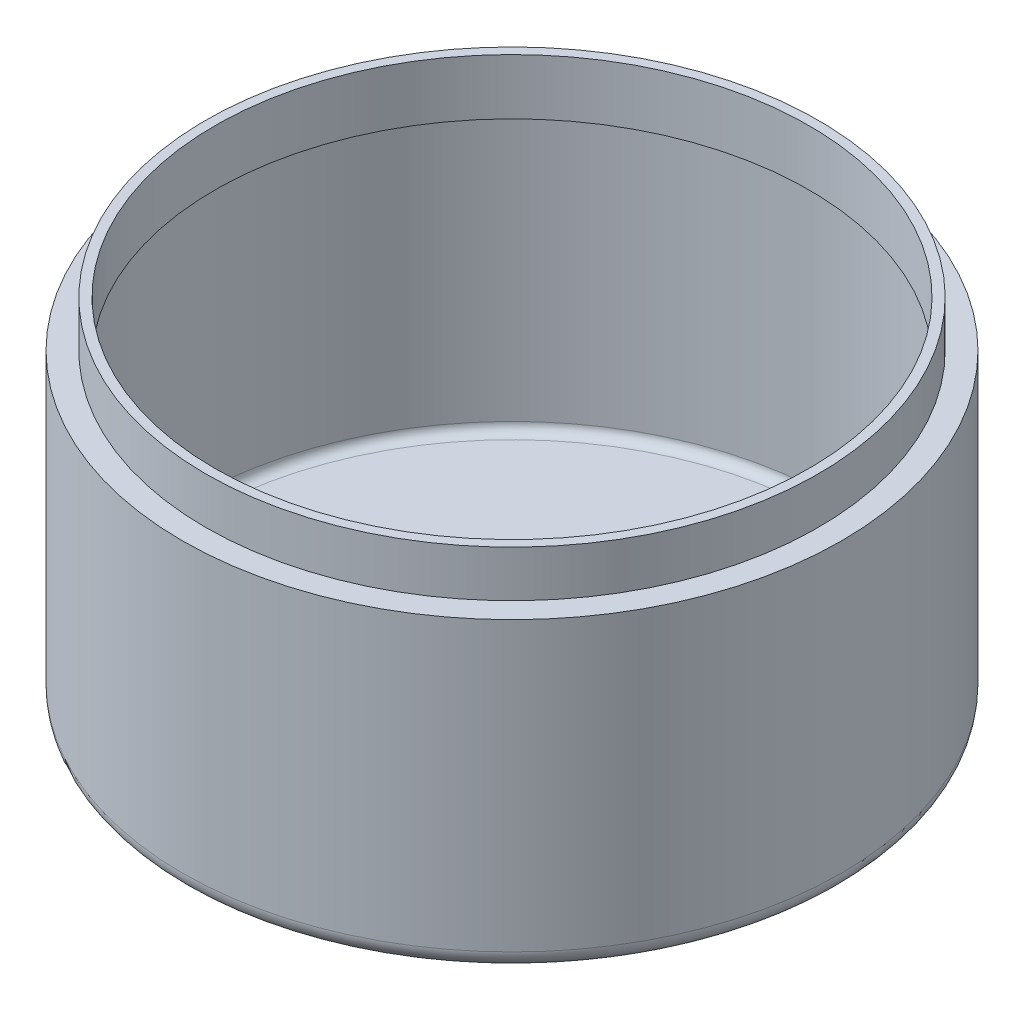
from build123d import *


with BuildPart() as part:
    # 草图1 → 旋转1 (revolve)
    with BuildSketch(Plane(origin=(0, 0, 0), x_dir=(0, 0, -1), z_dir=(1, 0, 0)), mode=Mode.PRIVATE) as revolve_1_sk:
        with BuildLine():
            Line((33, 0), (33, -5))
            Line((33, -5), (35.5, -5))
            Line((35.5, -5), (35.5, -36))
            ThreePointArc((35.5, -36), (34.914213562, -37.414213562), (33.5, -38))
            Line((33.5, -38), (0, -38))
            Line((0, -38), (0, -37))
            Line((0, -37), (33.5, -37))
            ThreePointArc((33.5, -37), (34.207106781, -36.707106781), (34.5, -36))
            Line((34.5, -36), (34.5, -6))
            Line((34.5, -6), (32, -6))
            Line((32, -6), (32, 0))
            Line((32, 0), (33, 0))
        make_face()
    revolve(revolve_1_sk.sketch.rotate(Axis((0, 1.9, 0), (0, -1, 0)), 180), axis=Axis((0, 1.9, 0), (0, -1, 0)))


solid = part.part
